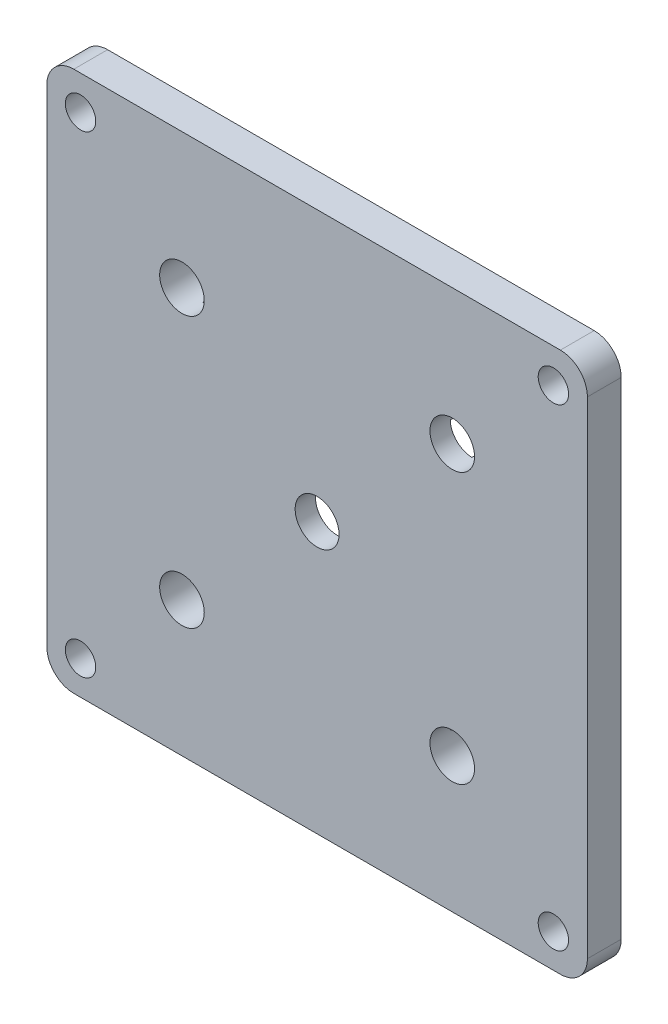
from build123d import *

# Parameters (mm, degrees)
BOSS_EXTRU_1_DEPTH      = 5
D_GAGEMENT_M41_D        = 4.5
ESQUISSE4_R             = 3.25
ENL_V_MAT_EXTRU_1_DEPTH = 57.789083458
D_GAGEMENT_M61_D        = 6.6
ENL_V_MAT_EXTRU_2_DEPTH = 2


with BuildPart() as part:
    # Esquisse1 → Boss.-Extru.1 (new body)
    with BuildSketch(Plane.XY):
        with BuildLine():
            Line((-36, -40), (36, -40))
            ThreePointArc((36, -40), (38.828427125, -38.828427125), (40, -36))
            Line((40, -36), (40, 36))
            ThreePointArc((40, 36), (38.828427125, 38.828427125), (36, 40))
            Line((36, 40), (-36, 40))
            ThreePointArc((-36, 40), (-38.828427125, 38.828427125), (-40, 36))
            Line((-40, 36), (-40, -36))
            ThreePointArc((-40, -36), (-38.828427125, -38.828427125), (-36, -40))
        make_face()
    extrude(amount=BOSS_EXTRU_1_DEPTH)

    # Dégagement M41 (through all)
    with Locations(Plane.XY.offset(5)):
        with Locations((-35.007622699, 34.962380164), (34.968353645, 34.962380164), (34.968353645, -35.023881333), (-35.007622699, -35.023881333)):
            Hole(D_GAGEMENT_M41_D / 2)

    # Esquisse4 → Enlèv. mat.-Extru.1 (cut, through all)
    with BuildSketch(Plane(origin=(0, 0, 0), x_dir=(-1, 0, 0), z_dir=(0, 0, -1))):
        Circle(ESQUISSE4_R)
    extrude(amount=-ENL_V_MAT_EXTRU_1_DEPTH, mode=Mode.SUBTRACT)

    # Dégagement M61 (through all)
    with Locations(Plane.XY.offset(5)):
        with Locations((-20, 20), (20, 20), (20, -20), (-20, -20)):
            Hole(D_GAGEMENT_M61_D / 2)

    # Esquisse7 → Enlèv. mat.-Extru.2 (cut)
    with BuildSketch(Plane(origin=(0, 0, 0), x_dir=(-1, 0, 0), z_dir=(0, 0, -1))):
        with BuildLine():
            Line((-16, 20), (16, 20))
            add(Edge.make_bspline(
                [(16, 20), (19.65685425, 19.656854249), (20, 16)],
                knots=[0, 0, 0, 1, 1, 1], degree=2))
            Line((20, 16), (20, -16))
            add(Edge.make_bspline(
                [(20, -16), (19.65685425, -19.65685425), (16, -20)],
                knots=[0, 0, 0, 1, 1, 1], degree=2))
            Line((16, -20), (-16, -20))
            add(Edge.make_bspline(
                [(-16, -20), (-19.656854249, -19.65685425), (-20, -16)],
                knots=[0, 0, 0, 1, 1, 1], degree=2))
            Line((-20, -16), (-20, 16))
            add(Edge.make_bspline(
                [(-20, 16), (-19.656854249, 19.656854249), (-16, 20)],
                knots=[0, 0, 0, 1, 1, 1], degree=2))
        make_face()
    extrude(amount=-ENL_V_MAT_EXTRU_2_DEPTH, mode=Mode.SUBTRACT)


solid = part.part
